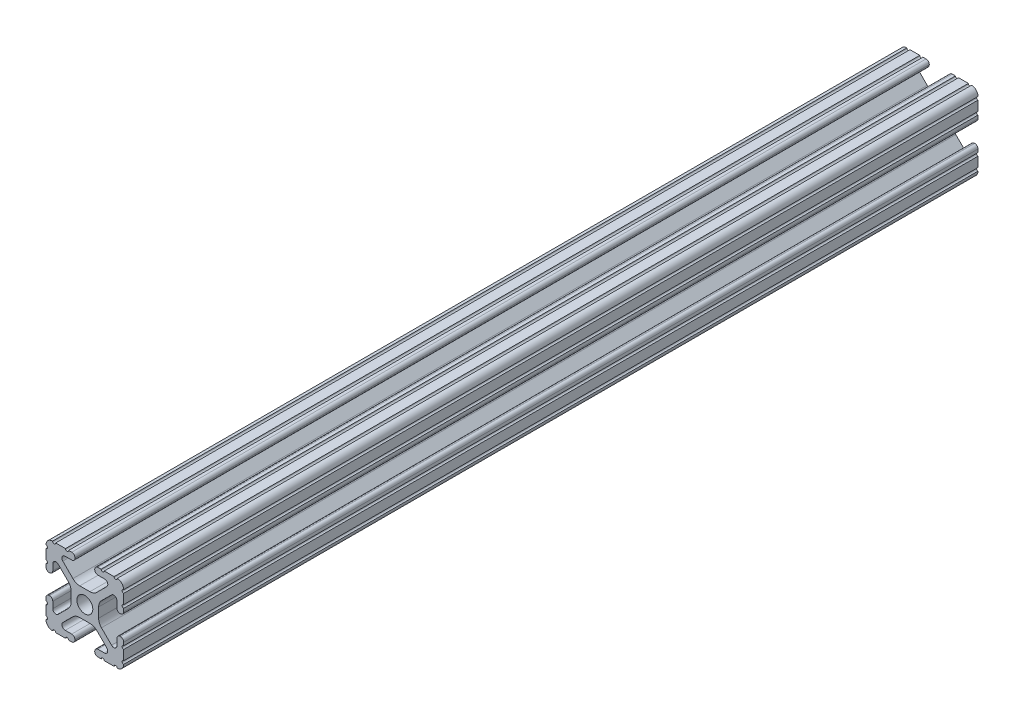
from build123d import *

# Parameters (mm, degrees)
SKETCH1_R           = 2.6035
BOSS_EXTRUDE1_DEPTH = 139.7


with BuildPart() as part:
    # Sketch1 → Boss-Extrude1 (new, symmetric)
    with BuildSketch(Plane.XY):
        with BuildLine():
            Line((-7.179650497, -8.645192506), (-3.952270251, -5.423690499))
            ThreePointArc((-3.952270251, -5.423690499), (-2.922936451, -4.736929036), (-1.709253557, -4.4958))
            Line((-1.709253557, -4.4958), (1.709253557, -4.4958))
            ThreePointArc((1.709253557, -4.4958), (2.922936451, -4.736929036), (3.952270251, -5.423690499))
            Line((3.952270251, -5.423690499), (7.179650497, -8.645192506))
            ThreePointArc((7.179650497, -8.645192506), (7.41473083, -9.822813117), (6.416408329, -10.4902))
            Line((6.416408329, -10.4902), (4.287512407, -10.4902))
            ThreePointArc((4.287512407, -10.4902), (3.54574862, -10.79744862), (3.2385, -11.539212407))
            Line((3.2385, -11.539212407), (3.2385, -11.650987593))
            ThreePointArc((3.2385, -11.650987593), (3.54574862, -12.39275138), (4.287512407, -12.7))
            Line((4.287512407, -12.7), (5.317126718, -12.7))
            ThreePointArc((5.317126718, -12.7), (5.825126718, -12.192), (6.333126718, -12.7))
            Line((6.333126718, -12.7), (9.550443118, -12.7))
            ThreePointArc((9.550443118, -12.7), (10.058366869, -12.192000006), (10.566443095, -12.699847501))
            ThreePointArc((10.566443095, -12.699847501), (12.082537762, -12.08250727), (12.699846982, -10.566399977))
            ThreePointArc((12.699846982, -10.566399977), (12.192000006, -10.058323491), (12.7, -9.5504))
            Line((12.7, -9.5504), (12.7, -6.3330836))
            ThreePointArc((12.7, -6.3330836), (12.192, -5.8250836), (12.7, -5.3170836))
            Line((12.7, -5.3170836), (12.7, -4.287469289))
            ThreePointArc((12.7, -4.287469289), (12.39275138, -3.545705502), (11.650987593, -3.238456882))
            Line((11.650987593, -3.238456882), (11.539212407, -3.238456882))
            ThreePointArc((11.539212407, -3.238456882), (10.79744862, -3.545705502), (10.4902, -4.287469289))
            Line((10.4902, -4.287469289), (10.4902, -6.402089023))
            ThreePointArc((10.4902, -6.402089023), (9.856505071, -7.351067942), (8.737131347, -7.129408934))
            Line((8.737131347, -7.129408934), (5.441005833, -3.840816462))
            ThreePointArc((5.441005833, -3.840816462), (4.750877967, -2.809883091), (4.5085, -1.593185507))
            Line((4.5085, -1.593185507), (4.5085, 1.593185507))
            ThreePointArc((4.5085, 1.593185507), (4.750877967, 2.809883091), (5.441005833, 3.840816462))
            Line((5.441005833, 3.840816462), (8.737131347, 7.129408934))
            ThreePointArc((8.737131347, 7.129408934), (9.856505071, 7.351067942), (10.4902, 6.402089023))
            Line((10.4902, 6.402089023), (10.4902, 4.287469289))
            ThreePointArc((10.4902, 4.287469289), (10.79744862, 3.545705502), (11.539212407, 3.238456882))
            Line((11.539212407, 3.238456882), (11.650987593, 3.238456882))
            ThreePointArc((11.650987593, 3.238456882), (12.39275138, 3.545705502), (12.7, 4.287469289))
            Line((12.7, 4.287469289), (12.7, 5.3170836))
            ThreePointArc((12.7, 5.3170836), (12.192, 5.8250836), (12.7, 6.3330836))
            Line((12.7, 6.3330836), (12.7, 9.5504))
            ThreePointArc((12.7, 9.5504), (12.192000006, 10.058323491), (12.699846982, 10.566399977))
            ThreePointArc((12.699846982, 10.566399977), (12.082537762, 12.08250727), (10.566443095, 12.699847501))
            ThreePointArc((10.566443095, 12.699847501), (10.058366869, 12.192000006), (9.550443118, 12.7))
            Line((9.550443118, 12.7), (6.333126718, 12.7))
            ThreePointArc((6.333126718, 12.7), (5.825126718, 12.192), (5.317126718, 12.7))
            Line((5.317126718, 12.7), (4.287512407, 12.7))
            ThreePointArc((4.287512407, 12.7), (3.54574862, 12.39275138), (3.2385, 11.650987593))
            Line((3.2385, 11.650987593), (3.2385, 11.539212407))
            ThreePointArc((3.2385, 11.539212407), (3.54574862, 10.79744862), (4.287512407, 10.4902))
            Line((4.287512407, 10.4902), (6.476788598, 10.4902))
            ThreePointArc((6.476788598, 10.4902), (7.432222385, 9.85140422), (7.207036008, 8.724370562))
            Line((7.207036008, 8.724370562), (3.898272566, 5.423169045))
            ThreePointArc((3.898272566, 5.423169045), (2.869120213, 4.736787962), (1.655778399, 4.4958))
            Line((1.655778399, 4.4958), (-1.655778399, 4.4958))
            ThreePointArc((-1.655778399, 4.4958), (-2.869120213, 4.736787962), (-3.898272566, 5.423169045))
            Line((-3.898272566, 5.423169045), (-7.207036008, 8.724370562))
            ThreePointArc((-7.207036008, 8.724370562), (-7.432222385, 9.85140422), (-6.476788598, 10.4902))
            Line((-6.476788598, 10.4902), (-4.287512407, 10.4902))
            ThreePointArc((-4.287512407, 10.4902), (-3.54574862, 10.79744862), (-3.2385, 11.539212407))
            Line((-3.2385, 11.539212407), (-3.2385, 11.650987593))
            ThreePointArc((-3.2385, 11.650987593), (-3.54574862, 12.39275138), (-4.287512407, 12.7))
            Line((-4.287512407, 12.7), (-5.317126718, 12.7))
            ThreePointArc((-5.317126718, 12.7), (-5.825126718, 12.192), (-6.333126718, 12.7))
            Line((-6.333126718, 12.7), (-9.550443118, 12.7))
            ThreePointArc((-9.550443118, 12.7), (-10.058366869, 12.192000006), (-10.566443095, 12.699847501))
            ThreePointArc((-10.566443095, 12.699847501), (-12.082537762, 12.08250727), (-12.699846982, 10.566399977))
            ThreePointArc((-12.699846982, 10.566399977), (-12.192000006, 10.058323491), (-12.7, 9.5504))
            Line((-12.7, 9.5504), (-12.7, 6.3330836))
            ThreePointArc((-12.7, 6.3330836), (-12.192, 5.8250836), (-12.7, 5.3170836))
            Line((-12.7, 5.3170836), (-12.7, 4.287469289))
            ThreePointArc((-12.7, 4.287469289), (-12.39275138, 3.545705502), (-11.650987593, 3.238456882))
            Line((-11.650987593, 3.238456882), (-11.539212407, 3.238456882))
            ThreePointArc((-11.539212407, 3.238456882), (-10.79744862, 3.545705502), (-10.4902, 4.287469289))
            Line((-10.4902, 4.287469289), (-10.4902, 6.402089023))
            ThreePointArc((-10.4902, 6.402089023), (-9.856505071, 7.351067942), (-8.737131347, 7.129408934))
            Line((-8.737131347, 7.129408934), (-5.441005833, 3.840816462))
            ThreePointArc((-5.441005833, 3.840816462), (-4.750877967, 2.809883091), (-4.5085, 1.593185507))
            Line((-4.5085, 1.593185507), (-4.5085, -1.593185507))
            ThreePointArc((-4.5085, -1.593185507), (-4.750877967, -2.809883091), (-5.441005833, -3.840816462))
            Line((-5.441005833, -3.840816462), (-8.737131347, -7.129408934))
            ThreePointArc((-8.737131347, -7.129408934), (-9.856505071, -7.351067942), (-10.4902, -6.402089023))
            Line((-10.4902, -6.402089023), (-10.4902, -4.287469289))
            ThreePointArc((-10.4902, -4.287469289), (-10.79744862, -3.545705502), (-11.539212407, -3.238456882))
            Line((-11.539212407, -3.238456882), (-11.650987593, -3.238456882))
            ThreePointArc((-11.650987593, -3.238456882), (-12.39275138, -3.545705502), (-12.7, -4.287469289))
            Line((-12.7, -4.287469289), (-12.7, -5.3170836))
            ThreePointArc((-12.7, -5.3170836), (-12.192, -5.8250836), (-12.7, -6.3330836))
            Line((-12.7, -6.3330836), (-12.7, -9.5504))
            ThreePointArc((-12.7, -9.5504), (-12.192000006, -10.058323491), (-12.699846982, -10.566399977))
            ThreePointArc((-12.699846982, -10.566399977), (-12.082537762, -12.08250727), (-10.566443095, -12.699847501))
            ThreePointArc((-10.566443095, -12.699847501), (-10.058366869, -12.192000006), (-9.550443118, -12.7))
            Line((-9.550443118, -12.7), (-6.333126718, -12.7))
            ThreePointArc((-6.333126718, -12.7), (-5.825126718, -12.192), (-5.317126718, -12.7))
            Line((-5.317126718, -12.7), (-4.287512407, -12.7))
            ThreePointArc((-4.287512407, -12.7), (-3.54574862, -12.39275138), (-3.2385, -11.650987593))
            Line((-3.2385, -11.650987593), (-3.2385, -11.539212407))
            ThreePointArc((-3.2385, -11.539212407), (-3.54574862, -10.79744862), (-4.287512407, -10.4902))
            Line((-4.287512407, -10.4902), (-6.416408329, -10.4902))
            ThreePointArc((-6.416408329, -10.4902), (-7.41473083, -9.822813117), (-7.179650497, -8.645192506))
        make_face()
        Circle(SKETCH1_R, mode=Mode.SUBTRACT)
    extrude(amount=BOSS_EXTRUDE1_DEPTH, both=True)


solid = part.part
